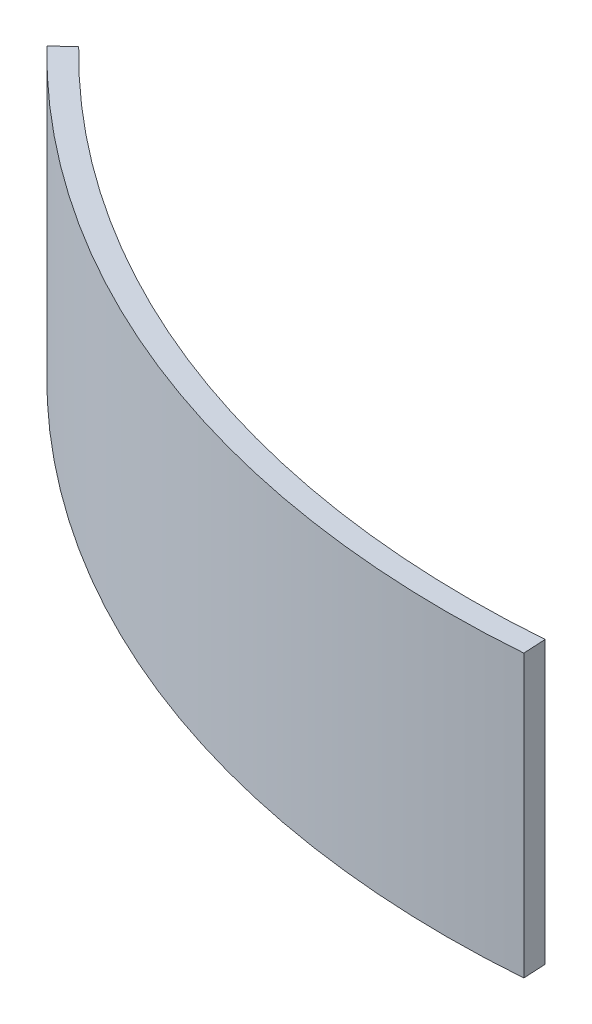
from build123d import *

# Parameters (mm, degrees)
SKETCH1_W = 2
SKETCH1_H = 25


with BuildPart() as part:
    # Sweep1: sweep along a path in Sketch2
    with BuildLine(Plane(origin=(0, 0, 0), x_dir=(1, 0, 0), z_dir=(0, 1, 0))) as sweep1_path:
        ThreePointArc((-62.552338709, 26.43865908), (-31.787293539, 6.393821216), (4.566621001, 1.228898482))
    # Sketch1 → Sweep1 (sweep)
    with BuildSketch(Plane(origin=(0, 0, 0), x_dir=(0, 0, -1), z_dir=(1, 0, 0))):
        with Locations((1, -12.5)):
            Rectangle(SKETCH1_W, SKETCH1_H)
    sweep(path=sweep1_path.line)


solid = part.part
